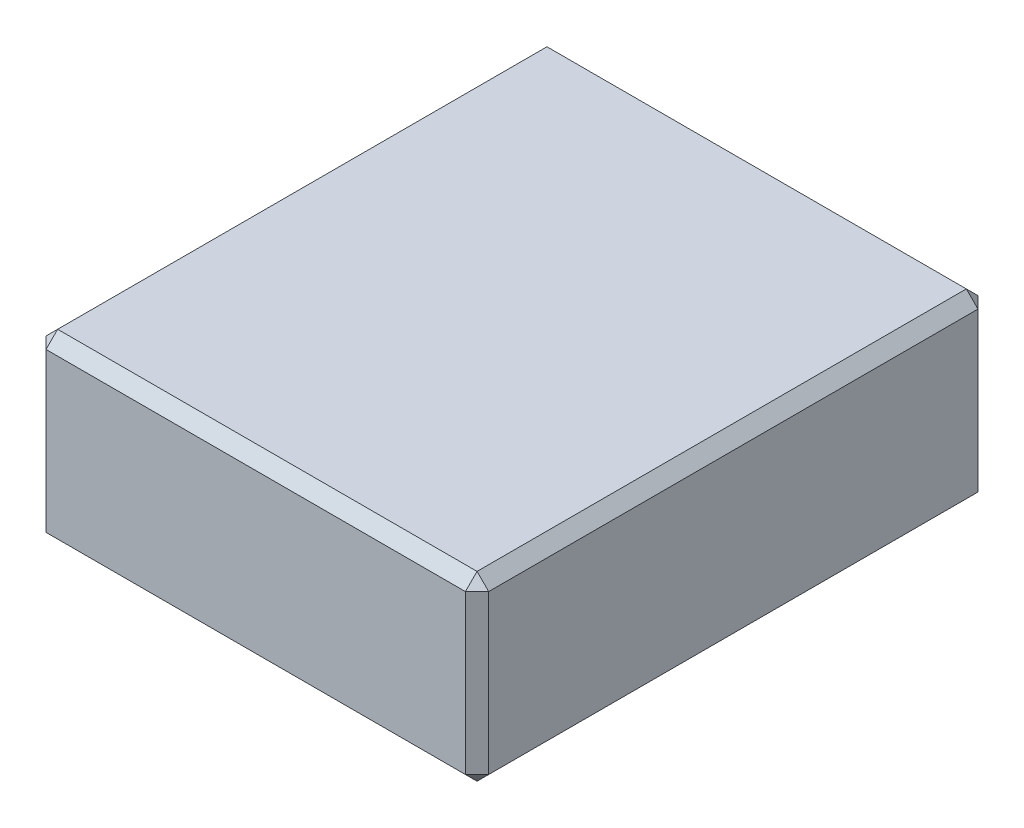
from build123d import *

# Parameters (mm, degrees)
SKETCH_1_W      = 190
SKETCH_1_H      = 220
EXTRUDE_1_DEPTH = 78
CHAMFER_1_SIZE  = 5


with BuildPart() as part:
    # 草图1 → 凸台-拉伸1 (new body)
    with BuildSketch(Plane(origin=(0, 0, 0), x_dir=(1, 0, 0), z_dir=(0, 1, 0))):
        Rectangle(SKETCH_1_W, SKETCH_1_H)
    extrude(amount=EXTRUDE_1_DEPTH)

    # 倒角1
    chamfer_1_edges = [part.edges().sort_by_distance(p)[0] for p in [
        (-95, 78, 0),
        (0, 78, 110),
        (95, 78, 0),
        (0, 0, 110),
        (-95, 0, 0),
        (0, 0, -110),
        (95, 0, 0),
        (95, 39, 110),
        (-95, 39, 110),
        (-95, 39, -110),
        (95, 39, -110),
        (0, 78, -110),
    ]]
    chamfer(chamfer_1_edges, length=CHAMFER_1_SIZE)


solid = part.part
